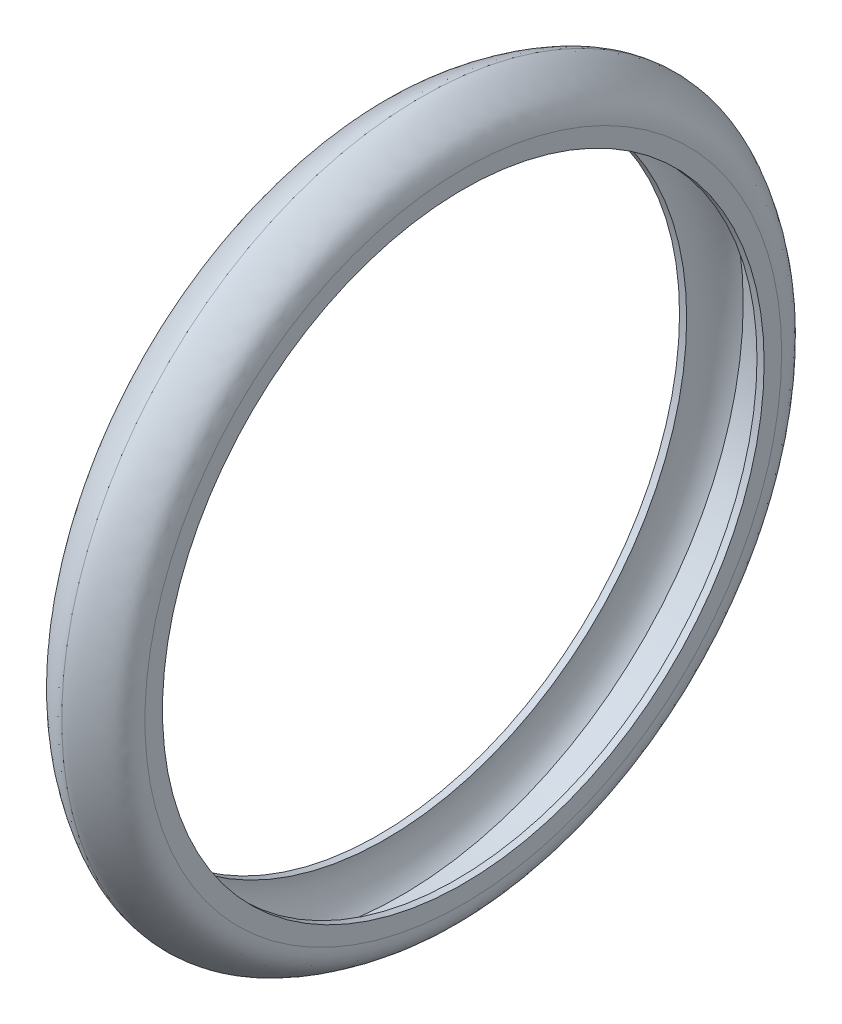
from build123d import *


with BuildPart() as part:
    # Sketch1 → Revolve2 (revolve)
    with BuildSketch(Plane.XY, mode=Mode.PRIVATE) as revolve2_sk:
        with BuildLine():
            add(Edge.make_bspline(
                [(0, 34.128413699), (0.661029516, 34.118573615), (3.46934179, 32.450692205), (4.018027359, 31.543185561), (4.018027359, 30.238684994)],
                knots=[0.504084479, 0.504084479, 0.504084479, 0.504084479, 0.667615187, 1, 1, 1, 1], degree=3))
            Line((4.018027359, 30.238684994), (4.018027359, 28.575))
            Line((4.018027359, 28.575), (3.339158483, 28.575))
            ThreePointArc((3.339158483, 28.575), (3.10555268, 30.719618246), (1.905, 32.512))
            Line((1.905, 32.512), (-1.905, 32.512))
            ThreePointArc((-1.905, 32.512), (-3.10555268, 30.719618246), (-3.339158483, 28.575))
            Line((-3.339158483, 28.575), (-4.018027359, 28.575))
            Line((-4.018027359, 28.575), (-4.018027359, 30.238684994))
            add(Edge.make_bspline(
                [(0, 34.128413699), (-0.661029516, 34.118573615), (-3.46934179, 32.450692205), (-4.018027359, 31.543185561), (-4.018027359, 30.238684994)],
                knots=[0.504084479, 0.504084479, 0.504084479, 0.504084479, 0.667615187, 1, 1, 1, 1], degree=3))
        make_face()
    revolve(revolve2_sk.sketch.rotate(Axis((15.577444869, 0, 0), (-1, 0, 0)), 90), axis=Axis((15.577444869, 0, 0), (-1, 0, 0)))


solid = part.part
